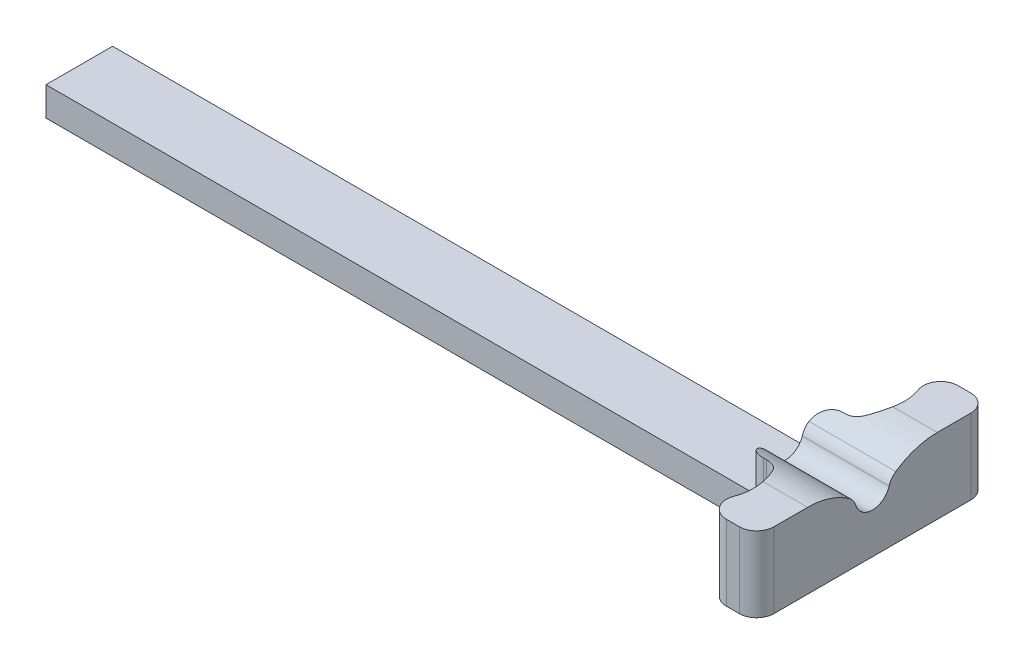
from build123d import *

# Parameters (mm, degrees)
EXTRUDE_1_DEPTH     = 13
EXTRUDE_2_DEPTH     = 5
CUT_EXTRUDE_1_DEPTH = 140.061137634


with BuildPart() as part:
    # 草图1 → 凸台-拉伸1 (new body)
    with BuildSketch(Plane(origin=(0, 0, 0), x_dir=(1, 0, 0), z_dir=(0, 1, 0))):
        with BuildLine():
            Line((122, 3.83772234), (122, -3.83772234))
            ThreePointArc((122, -3.83772234), (122.878679656, -5.959042683), (125, -6.83772234))
            Line((125, -6.83772234), (125.5, -6.83772234))
            ThreePointArc((125.5, -6.83772234), (126.882997438, -7.175520603), (127.954545455, -8.112843616))
            ThreePointArc((127.954545455, -8.112843616), (129.429754152, -11.909474928), (128.969252111, -15.956521739))
            ThreePointArc((128.969252111, -15.956521739), (129.319163119, -18.713120722), (131.781929326, -20))
            Line((131.781929326, -20), (134, -20))
            ThreePointArc((134, -20), (136.121320344, -19.121320344), (137, -17))
            Line((137, -17), (137, 17))
            ThreePointArc((137, 17), (136.121320344, 19.121320344), (134, 20))
            Line((134, 20), (131.781929326, 20))
            ThreePointArc((131.781929326, 20), (129.319163119, 18.713120722), (128.969252111, 15.956521739))
            ThreePointArc((128.969252111, 15.956521739), (129.429754152, 11.909474928), (127.954545455, 8.112843616))
            ThreePointArc((127.954545455, 8.112843616), (126.882997438, 7.175520603), (125.5, 6.83772234))
            Line((125.5, 6.83772234), (125, 6.83772234))
            ThreePointArc((125, 6.83772234), (122.878679656, 5.959042683), (122, 3.83772234))
        make_face()
    extrude(amount=EXTRUDE_1_DEPTH)

    # 草图1<3> → 凸台-拉伸2 (add)
    with BuildSketch(Plane(origin=(0, 0, 0), x_dir=(1, 0, 0), z_dir=(0, 1, 0))):
        with BuildLine():
            Line((0, 5.75), (0, -5.75))
            Line((0, -5.75), (122.68846498, -5.75))
            ThreePointArc((122.68846498, -5.75), (122.177358944, -4.853939575), (122, -3.83772234))
            Line((122, -3.83772234), (122, 3.83772234))
            ThreePointArc((122, 3.83772234), (122.177358944, 4.853939575), (122.68846498, 5.75))
            Line((122.68846498, 5.75), (0, 5.75))
        make_face()
    extrude(amount=EXTRUDE_2_DEPTH)

    # 草图2 → 切除-拉伸1 (cut, through all)
    with BuildSketch(Plane(origin=(137, 0, 0), x_dir=(0, 0, -1), z_dir=(1, 0, 0))):
        with BuildLine():
            Line((-11.193056067, 13), (11.193056067, 13))
            ThreePointArc((11.193056067, 13), (7.438767237, 12.422890395), (4.031140189, 10.74485046))
            ThreePointArc((4.031140189, 10.74485046), (3.317442984, 10.041838714), (2.875, 9.143043175))
            ThreePointArc((2.875, 9.143043175), (0, 7), (-2.875, 9.143043175))
            ThreePointArc((-2.875, 9.143043175), (-3.317442984, 10.041838714), (-4.031140189, 10.74485046))
            ThreePointArc((-4.031140189, 10.74485046), (-7.438767237, 12.422890395), (-11.193056067, 13))
        make_face()
    extrude(amount=-CUT_EXTRUDE_1_DEPTH, mode=Mode.SUBTRACT)


solid = part.part
